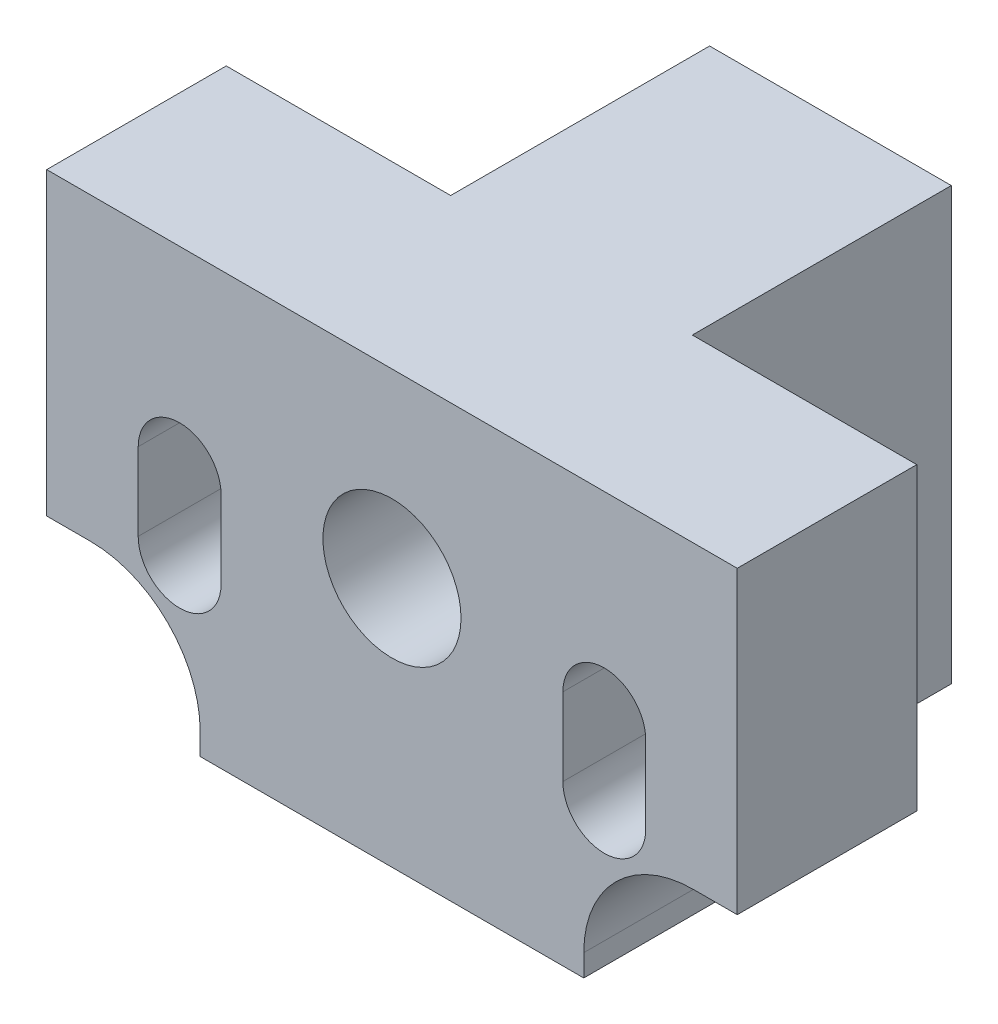
from build123d import *
from build123d.topology import SkipClean

# Parameters (mm, degrees)
BOSS_EXTRUDE1_DEPTH = 25
CUT_EXTRUDE1_DEPTH  = 41.867591072
SKETCH8_R           = 4
CUT_EXTRUDE2_DEPTH  = 41.867591072
CUT_EXTRUDE3_DEPTH  = 36.355339059


with BuildPart() as part:
    # Sketch6 → Boss-Extrude1 (new body)
    with BuildSketch(Plane(origin=(0, 0, 0), x_dir=(1, 0, 0), z_dir=(0, 1, 0))):
        Polygon((0, 0), (-20, 0), (-20, 10.4), (-7, 10.4), (-7, 25.4), (0, 25.4), align=None)
    extrude(amount=BOSS_EXTRUDE1_DEPTH)

    # Sketch7 → Cut-Extrude1 (cut, through all)
    with BuildSketch(Plane.XY):
        with BuildLine():
            Line((-9.9, 13.75), (-9.9, 9.25))
            ThreePointArc((-9.9, 9.25), (-12.3, 6.85), (-14.7, 9.25))
            Line((-14.7, 9.25), (-14.7, 13.75))
            ThreePointArc((-14.7, 13.75), (-12.3, 16.15), (-9.9, 13.75))
        make_face()
    extrude(amount=-CUT_EXTRUDE1_DEPTH, mode=Mode.SUBTRACT)

    # Sketch8 → Cut-Extrude2 (cut, through all)
    with BuildSketch(Plane.XY):
        with Locations((0, 14.49399695)):
            Circle(SKETCH8_R)
    extrude(amount=-CUT_EXTRUDE2_DEPTH, mode=Mode.SUBTRACT)

    # Sketch9 → Cut-Extrude3 (cut, through all)
    with BuildSketch(Plane(origin=(0, 0, -10.4), x_dir=(-1, 0, 0), z_dir=(0, 0, -1))):
        with BuildLine():
            Line((11.11, 0), (11.11, 1.27))
            ThreePointArc((11.11, 1.27), (12.969871939, 5.760128061), (17.46, 7.62))
            Line((17.46, 7.62), (20, 7.62))
            Line((20, 7.62), (20, 0))
            Line((20, 0), (11.11, 0))
        make_face()
    extrude(amount=-CUT_EXTRUDE3_DEPTH, mode=Mode.SUBTRACT)

    # Mirror1: part across plane


with BuildPart() as part_1:
    with SkipClean():  # the faces are left unmerged after this step: merging them gives an invalid solid
        add(part.part)
        add(part.part.mirror(Plane(origin=(0, 0, 0), x_dir=(0, 0, 1), z_dir=(1, 0, 0))))


solid = part_1.part
